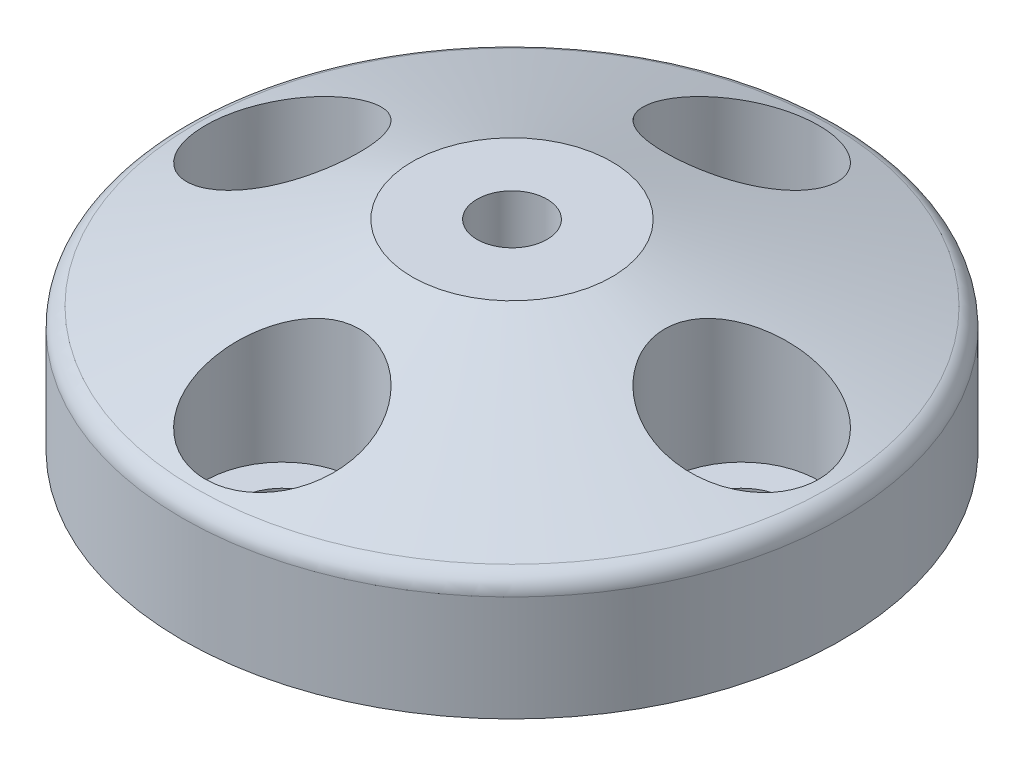
from build123d import *

# Parameters (mm, degrees)
SKETCH1_R           = 16.5
BOSS_EXTRUDE1_DEPTH = 6
SKETCH4_R           = 5
SKETCH6_R           = 3.85
CUT_EXTRUDE1_DEPTH  = 7.5
SKETCH7_R           = 1.75
CUT_EXTRUDE2_DEPTH  = 26.38700468
SKETCH9_R           = 2.25
CUT_EXTRUDE3_DEPTH  = 25.834452009
FILLET1_R           = 1
CUT_EXTRUDE4_DEPTH  = 2.5


with BuildPart() as part:
    # Sketch1 → Boss-Extrude1 (new body)
    with BuildSketch(Plane(origin=(0, 0, 0), x_dir=(1, 0, 0), z_dir=(0, 1, 0))):
        with Locations(Location((0, 0, 0), (0, 0, 270))):
            Circle(SKETCH1_R)
    extrude(amount=-BOSS_EXTRUDE1_DEPTH)

    # Sketch4 → section 0 of loft1
    with BuildSketch(Plane(origin=(0, 4, 0), x_dir=(1, 0, 0), z_dir=(0, 1, 0)), mode=Mode.PRIVATE) as loft1_s0:
        Circle(SKETCH4_R)
    # loft up to a face of the part (loft1)
    loft([loft1_s0.sketch, part.faces().sort_by_distance((0, 0, 0))[0]])

    # Sketch6 → Cut-Extrude1 (cut)
    with BuildSketch(Plane(origin=(0, 4, 0), x_dir=(1, 0, 0), z_dir=(0, 1, 0))):
        with Locations(Location((0, 11.5, 0), (0, 0, 270))):
            Circle(SKETCH6_R)
        with Locations(Location((11.5, 0, 0), (0, 0, 270))):
            Circle(SKETCH6_R)
        with Locations(Location((0, -11.5, 0), (0, 0, 269.999999981))):
            Circle(SKETCH6_R)
        with Locations(Location((-11.5, 0, 0), (0, 0, 270))):
            Circle(SKETCH6_R)
    extrude(amount=-CUT_EXTRUDE1_DEPTH, mode=Mode.SUBTRACT)

    # Sketch7 → Cut-Extrude2 (cut, through all)
    with BuildSketch(Plane(origin=(0, 4, 0), x_dir=(1, 0, 0), z_dir=(0, 1, 0))):
        with Locations(Location((0, 0, 0), (0, 0, 270))):
            Circle(SKETCH7_R)
    extrude(amount=-CUT_EXTRUDE2_DEPTH, mode=Mode.SUBTRACT)

    # Sketch9 → Cut-Extrude3 (cut, through all)
    with BuildSketch(Plane(origin=(0, 2.5, 0), x_dir=(1, 0, 0), z_dir=(0, 1, 0))):
        with Locations(Location((0, 11.5, 0), (0, 0, 270))):
            Circle(SKETCH9_R)
        with Locations(Location((11.5, 0, 0), (0, 0, 270))):
            Circle(SKETCH9_R)
        with Locations(Location((0, -11.5, 0), (0, 0, 270))):
            Circle(SKETCH9_R)
        with Locations(Location((-11.5, 0, 0), (0, 0, 270))):
            Circle(SKETCH9_R)
    extrude(amount=-CUT_EXTRUDE3_DEPTH, mode=Mode.SUBTRACT)

    # Fillet1
    fillet1_edges = [part.edges().sort_by_distance(p)[0] for p in [
        (11.66726189, 0, 11.66726189),
    ]]
    fillet(fillet1_edges, radius=FILLET1_R)

    # Sketch10 → Cut-Extrude4 (cut)
    with BuildSketch(Plane.XZ.offset(6)):
        Polygon((1.732050808, -3), (3.464101615, 0), (1.732050808, 3), (-1.732050808, 3), (-3.464101615, 0), (-1.732050808, -3), align=None)
    extrude(amount=-CUT_EXTRUDE4_DEPTH, mode=Mode.SUBTRACT)


solid = part.part
